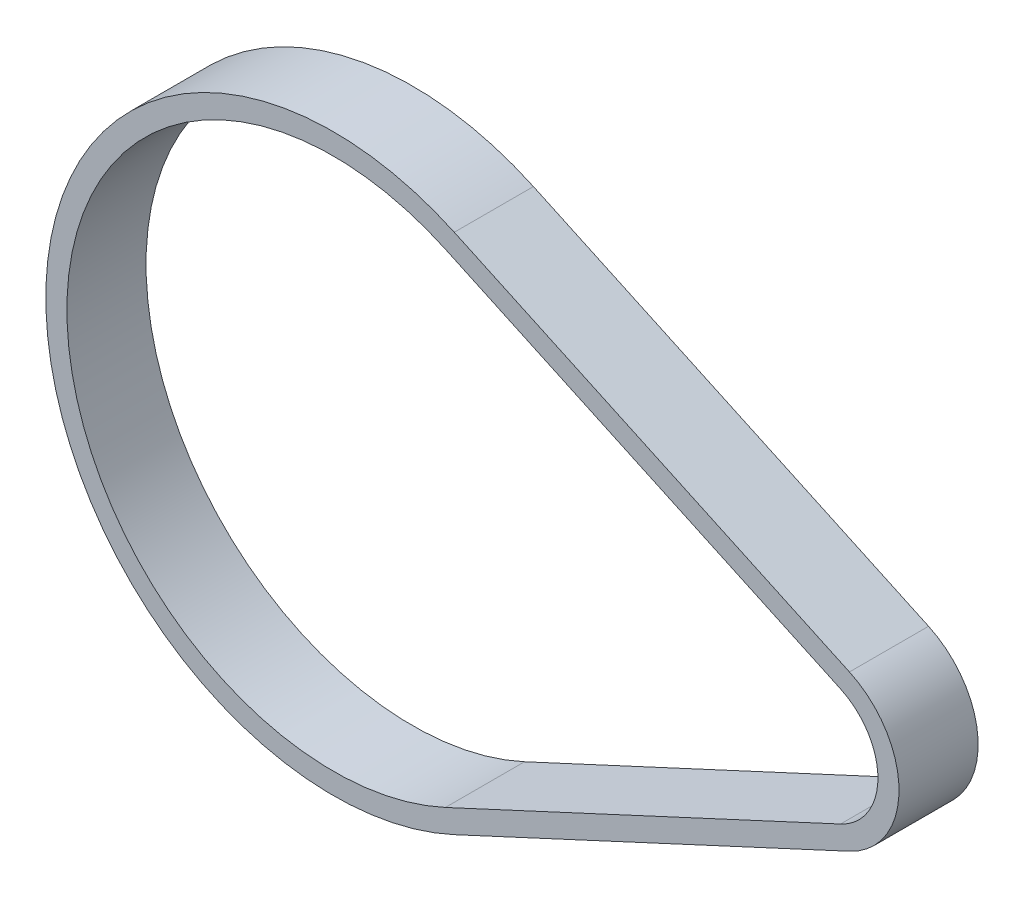
from build123d import *

# Parameters (mm, degrees)
BOSS_EXTRUDE1_DEPTH = 7.5


with BuildPart() as part:
    # Sketch1 → Boss-Extrude1 (new body)
    with BuildSketch(Plane.XY):
        with BuildLine():
            Line((-11.287032967, 24.721708816), (26.161547253, 7.357543431))
            ThreePointArc((26.161547253, 7.357543431), (30.86, 0), (26.161547253, -7.357543431))
            Line((26.161547253, -7.357543431), (-11.287032967, -24.721708816))
            ThreePointArc((-11.287032967, -24.721708816), (-50, 0), (-11.287032967, 24.721708816))
        make_face()
        with BuildLine():
            Line((-12.128351648, 22.907271472), (25.320228571, 5.543106087))
            ThreePointArc((25.320228571, 5.543106087), (28.86, 0), (25.320228571, -5.543106087))
            Line((25.320228571, -5.543106087), (-12.128351648, -22.907271472))
            ThreePointArc((-12.128351648, -22.907271472), (-48, 0), (-12.128351648, 22.907271472))
        make_face(mode=Mode.SUBTRACT)
    extrude(amount=BOSS_EXTRUDE1_DEPTH)


solid = part.part
